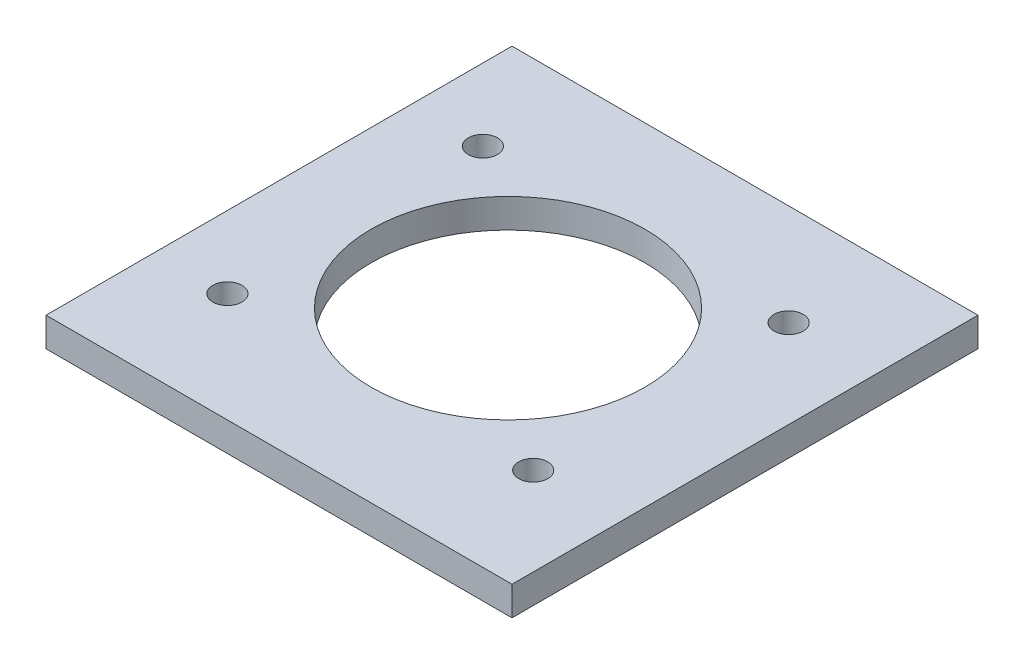
from build123d import *

# Parameters (mm, degrees)
SKETCH1_W           = 64
SKETCH1_H           = 64
SKETCH1_R           = 18.8
SKETCH1_R_2         = 2
BOSS_EXTRUDE4_DEPTH = 4


with BuildPart() as part:
    # Sketch1 → Boss-Extrude4 (new body)
    with BuildSketch(Plane(origin=(0, 0, 0), x_dir=(1, 0, 0), z_dir=(0, 1, 0))):
        with Locations((32, 32)):
            Rectangle(SKETCH1_W, SKETCH1_H)
        with Locations(Location((30.89292515, 32.55887383, 0), (0, 0, 270))):
            Circle(SKETCH1_R, mode=Mode.SUBTRACT)
        with Locations(Location((9.89792515, 15.01387383, 0), (0, 0, 270))):
            Circle(SKETCH1_R_2, mode=Mode.SUBTRACT)
        with Locations(Location((51.89792515, 15.01387383, 0), (0, 0, 270))):
            Circle(SKETCH1_R_2, mode=Mode.SUBTRACT)
        with Locations(Location((9.89792515, 50.09887383, 0), (0, 0, 270))):
            Circle(SKETCH1_R_2, mode=Mode.SUBTRACT)
        with Locations(Location((51.89292515, 50.09887383, 0), (0, 0, 270))):
            Circle(SKETCH1_R_2, mode=Mode.SUBTRACT)
    extrude(amount=BOSS_EXTRUDE4_DEPTH)


solid = part.part
